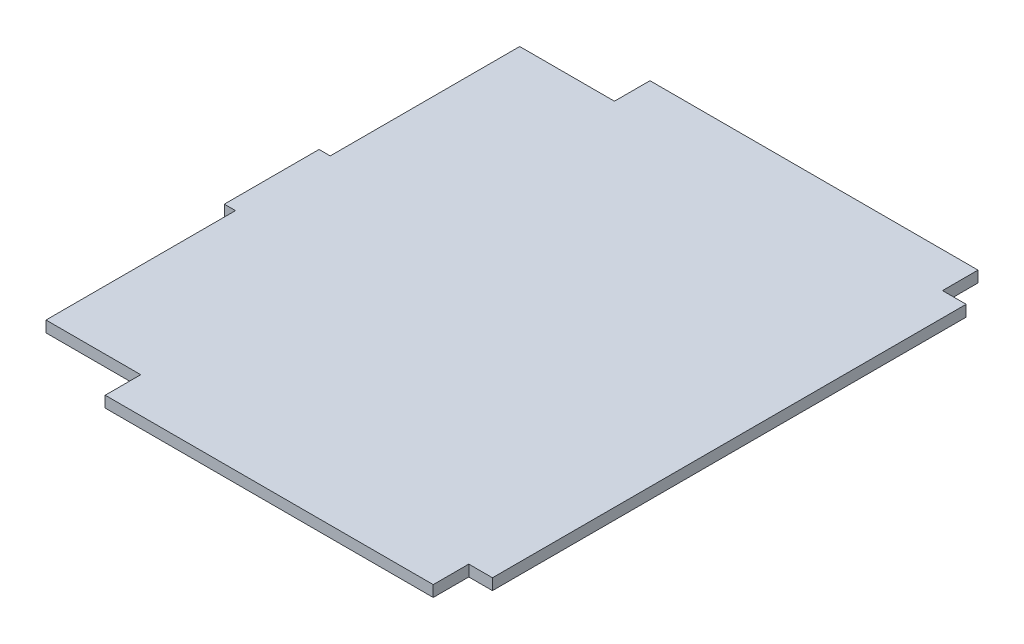
from build123d import *

# Parameters (mm, degrees)
BOSS_EXTRUDE1_DEPTH = 2.9972


with BuildPart() as part:
    # Sketch1 → Boss-Extrude1 (new body)
    with BuildSketch(Plane(origin=(0, 0, 0), x_dir=(1, 0, 0), z_dir=(0, 1, 0))):
        Polygon((-34.447343983, -73.025), (53.497343983, -73.025), (53.497343983, -63.5), (59.847343983, -63.5), (59.847343983, 63.5), (53.497343983, 63.5), (53.497343983, 73.025), (-34.447343983, 73.025), (-34.447343983, 63.5), (-59.847343983, 63.5), (-59.847343983, 12.7), (-62.844543983, 12.7), (-62.844543983, -12.7), (-59.847343983, -12.7), (-59.847343983, -63.5), (-34.447343983, -63.5), align=None)
    extrude(amount=BOSS_EXTRUDE1_DEPTH)


solid = part.part
